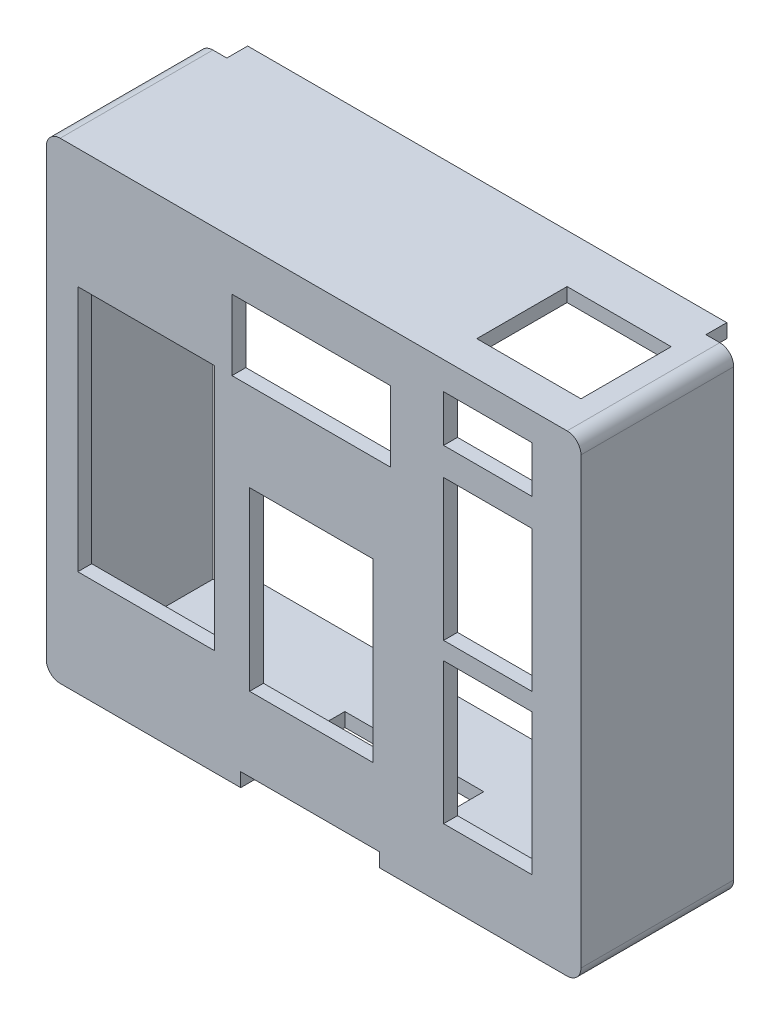
from build123d import *

# Parameters (mm, degrees)
SKETCH_1_W               = 73
SKETCH_1_H               = 64
SKETCH_1_W_2             = 22.86
SKETCH_1_H_2             = 10.16
SKETCH_1_W_3             = 12.7
SKETCH_1_H_3             = 20.32
SKETCH_1_W_4             = 19.66
SKETCH_1_H_4             = 35.56
SKETCH_1_W_5             = 17.78
SKETCH_1_H_5             = 25.4
EXTRUDE_1_DEPTH          = 2
SKETCH_2_W               = 77
SKETCH_2_H               = 68
SKETCH_2_W_2             = 73
SKETCH_2_H_2             = 64
EXTRUDE_2_DEPTH          = 25
FILLET_1_R               = 2
SKETCH_5_W               = 3
SKETCH_5_H               = 68
CUT_EXTRUDE_1_DEPTH      = 4
CUT_EXTRUDE_2_DEPTH      = 2
CUT_EXTRUDE_2_DEPTH_BACK = 2
SKETCH_7_W               = 3
SKETCH_7_H               = 68
SKETCH_8_W               = 20
SKETCH_8_H               = 15
CUT_EXTRUDE_3_DEPTH      = 2
SKETCH_9_W               = 15
SKETCH_9_H               = 13
CUT_EXTRUDE_4_DEPTH      = 2
SKETCH_10_W              = 12.7
SKETCH_10_H              = 6.7
CUT_EXTRUDE_5_DEPTH      = 2
EXTRUDE_3_DEPTH          = 5


with BuildPart() as part:
    # 草图1 → 凸台-拉伸1 (new body)
    with BuildSketch(Plane.XY):
        with Locations((36.5, -32)):
            Rectangle(SKETCH_1_W, SKETCH_1_H)
        with Locations((36.17, -10.16)):
            Rectangle(SKETCH_1_W_2, SKETCH_1_H_2, mode=Mode.SUBTRACT)
        with Locations((61.57, -22.86)):
            Rectangle(SKETCH_1_W_3, SKETCH_1_H_3, mode=Mode.SUBTRACT)
        with Locations((61.57, -45.72)):
            Rectangle(SKETCH_1_W_3, SKETCH_1_H_3, mode=Mode.SUBTRACT)
        with Locations((12.37, -33.02)):
            Rectangle(SKETCH_1_W_4, SKETCH_1_H_4, mode=Mode.SUBTRACT)
        with Locations((36.17, -40.64)):
            Rectangle(SKETCH_1_W_5, SKETCH_1_H_5, mode=Mode.SUBTRACT)
    extrude(amount=EXTRUDE_1_DEPTH)

    # 草图2 → 凸台-拉伸2 (add)
    with BuildSketch(Plane.XY.offset(2)):
        with Locations((36.5, -32)):
            Rectangle(SKETCH_2_W, SKETCH_2_H)
        with Locations((36.5, -32)):
            Rectangle(SKETCH_2_W_2, SKETCH_2_H_2, mode=Mode.SUBTRACT)
    extrude(amount=-EXTRUDE_2_DEPTH)

    # 圆角1
    fillet_1_edges = [part.edges().sort_by_distance(p)[0] for p in [
        (-2, 2, -10.5),
        (75, 2, -10.5),
        (75, -66, -10.5),
        (-2, -66, -10.5),
    ]]
    fillet(fillet_1_edges, radius=FILLET_1_R)

    # 草图5 → 切除-拉伸1 (cut)
    with BuildSketch(Plane(origin=(75, 0, 0), x_dir=(0, 0, -1), z_dir=(1, 0, 0))):
        with Locations((21.5, -32)):
            Rectangle(SKETCH_5_W, SKETCH_5_H)
    extrude(amount=-CUT_EXTRUDE_1_DEPTH, mode=Mode.SUBTRACT)

    # 草图7 → 切除-拉伸2 (cut, two sides: drawn at the far end of the back side and taken through both)
    with BuildSketch(Plane(origin=(0, 0, 0), x_dir=(0, 0, -1), z_dir=(1, 0, 0)).offset(-CUT_EXTRUDE_2_DEPTH_BACK)):
        with Locations((21.5, -32)):
            Rectangle(SKETCH_7_W, SKETCH_7_H)
    extrude(amount=CUT_EXTRUDE_2_DEPTH + CUT_EXTRUDE_2_DEPTH_BACK, mode=Mode.SUBTRACT)

    # 草图8 → 切除-拉伸3 (cut)
    with BuildSketch(Plane.XZ.offset(66)):
        with Locations((36, -5.5)):
            Rectangle(SKETCH_8_W, SKETCH_8_H)
    extrude(amount=-CUT_EXTRUDE_3_DEPTH, mode=Mode.SUBTRACT)

    # 草图9 → 切除-拉伸4 (cut)
    with BuildSketch(Plane(origin=(0, 2, 0), x_dir=(1, 0, 0), z_dir=(0, 1, 0))):
        with Locations((62.5, 9.5)):
            Rectangle(SKETCH_9_W, SKETCH_9_H)
    extrude(amount=-CUT_EXTRUDE_4_DEPTH, mode=Mode.SUBTRACT)

    # 草图10 → 切除-拉伸5 (cut)
    with BuildSketch(Plane.XY.offset(2)):
        with Locations((61.57, -5.35)):
            Rectangle(SKETCH_10_W, SKETCH_10_H)
    extrude(amount=-CUT_EXTRUDE_5_DEPTH, mode=Mode.SUBTRACT)

    # 草图12 → 凸台-拉伸3 (add)
    with BuildSketch(Plane(origin=(0, 0, 0), x_dir=(-1, 0, 0), z_dir=(0, 0, -1))):
        with BuildLine():
            Line((-1.5, -64), (0, -64))
            Line((0, -64), (0, -62.5))
            ThreePointArc((0, -62.5), (-2.560660172, -61.439339828), (-1.5, -64))
        make_face()
        with BuildLine():
            Line((-73, -64), (-73, -62.5))
            ThreePointArc((-73, -62.5), (-70.439339828, -61.439339828), (-71.5, -64))
            Line((-71.5, -64), (-73, -64))
        make_face()
        with BuildLine():
            Line((-71.5, 0), (-73, 0))
            Line((-73, 0), (-73, -1.5))
            ThreePointArc((-73, -1.5), (-70.439339828, -2.560660172), (-71.5, 0))
        make_face()
        with BuildLine():
            Line((0, 0), (0, -1.5))
            ThreePointArc((0, -1.5), (-2.560660172, -2.560660172), (-1.5, 0))
            Line((-1.5, 0), (0, 0))
        make_face()
    extrude(amount=EXTRUDE_3_DEPTH)


solid = part.part
